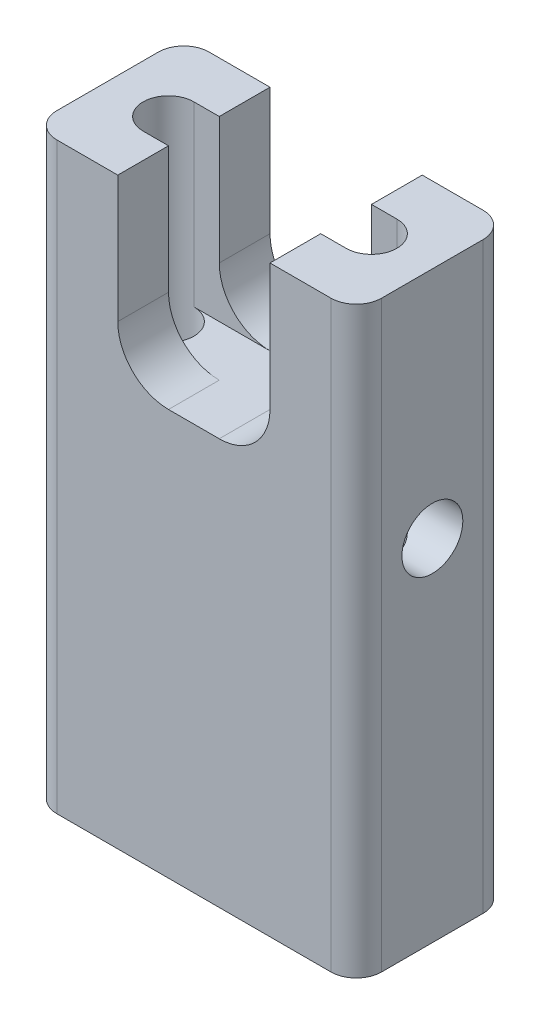
from build123d import *

# Parameters (mm, degrees)
BOSS_EXTRUDE1_DEPTH      = 35
BOSS_EXTRUDE1_DEPTH_BACK = 80
SKETCH1_W                = 64
SKETCH1_H                = 30
CUT_EXTRUDE1_DEPTH       = 10
CUT_EXTRUDE2_START       = -35
CUT_EXTRUDE2_DEPTH       = 35
CUT_EXTRUDE4_REACH       = 84.91
SKETCH6_R                = 8
SKETCH7_R                = 5
CUT_EXTRUDE5_DEPTH       = 65
CUT_EXTRUDE6_START       = -52
SKETCH8_R                = 6
CUT_EXTRUDE6_DEPTH       = 52
CUT_EXTRUDE7_DEPTH       = 35
CUT_EXTRUDE8_REACH       = 93.236
FILLET1_R                = 5


with BuildPart() as part:
    # Sketch1 → Boss-Extrude1 (new, two sides: drawn at the far end of the back side and taken through both)
    with BuildSketch(Plane(origin=(0, 0, 0), x_dir=(1, 0, 0), z_dir=(0, 1, 0)).offset(-BOSS_EXTRUDE1_DEPTH_BACK)):
        Rectangle(SKETCH1_W, SKETCH1_H)
    extrude(amount=BOSS_EXTRUDE1_DEPTH + BOSS_EXTRUDE1_DEPTH_BACK)

    # Sketch2 → Cut-Extrude1 (cut)
    with BuildSketch(Plane(origin=(0, -70, 0), x_dir=(1, 0, 0), z_dir=(0, 1, 0))):
        with BuildLine():
            Line((-24.5, 13), (24.5, 13))
            ThreePointArc((24.5, 13), (26.621320344, 12.121320344), (27.5, 10))
            Line((27.5, 10), (27.5, -10))
            ThreePointArc((27.5, -10), (26.621320344, -12.121320344), (24.5, -13))
            Line((24.5, -13), (-24.5, -13))
            ThreePointArc((-24.5, -13), (-26.621320344, -12.121320344), (-27.5, -10))
            Line((-27.5, -10), (-27.5, 10))
            ThreePointArc((-27.5, 10), (-26.621320344, 12.121320344), (-24.5, 13))
        make_face()
    extrude(amount=-CUT_EXTRUDE1_DEPTH, mode=Mode.SUBTRACT)

    # Sketch4 → Cut-Extrude2 (cut)
    with BuildSketch(Plane.XZ.offset(70).offset(CUT_EXTRUDE2_START)):
        with BuildLine():
            Line((-4.55, -12.177746097), (-22.1, -5.620498199))
            ThreePointArc((-22.1, -5.620498199), (-26, 0), (-22.1, 5.620498199))
            Line((-22.1, 5.620498199), (-4.55, 12.177746097))
            ThreePointArc((-4.55, 12.177746097), (13, 0), (-4.55, -12.177746097))
        make_face()
    extrude(amount=CUT_EXTRUDE2_DEPTH, mode=Mode.SUBTRACT)

    # Sketch6 → Cut-Extrude4 (cut, up to next)
    with BuildSketch(Plane(origin=(0, -5, 0), x_dir=(1, 0, 0), z_dir=(0, 1, 0)), mode=Mode.PRIVATE) as cut_extrude4_sk1:
        with Locations(Location((0, 0, 0), (0, 0, 180))):
            Circle(SKETCH6_R)
    cut_extrude4_tool1 = extrude(cut_extrude4_sk1.sketch, amount=-CUT_EXTRUDE4_REACH, mode=Mode.PRIVATE) & part.part
    add(cut_extrude4_tool1.solids().sort_by_distance((0, -5, 0))[0], mode=Mode.SUBTRACT)

    # Sketch7 → Cut-Extrude5 (cut)
    with BuildSketch(Plane(origin=(0, 35, 0), x_dir=(1, 0, 0), z_dir=(0, 1, 0))):
        with Locations(Location((20, 0, 0), (0, 0, 270))):
            Circle(SKETCH7_R)
        with Locations(Location((-20, 0, 0), (0, 0, 270))):
            Circle(SKETCH7_R)
    extrude(amount=-CUT_EXTRUDE5_DEPTH, mode=Mode.SUBTRACT)

    # Sketch8 → Cut-Extrude6 (cut)
    with BuildSketch(Plane(origin=(32, 0, 0), x_dir=(0, 0, -1), z_dir=(1, 0, 0)).offset(CUT_EXTRUDE6_START)):
        with Locations((0, -11)):
            Circle(SKETCH8_R)
    extrude(amount=CUT_EXTRUDE6_DEPTH, mode=Mode.SUBTRACT)

    # Sketch12 → Cut-Extrude7 (cut)
    with BuildSketch(Plane(origin=(0, 35, 0), x_dir=(1, 0, 0), z_dir=(0, 1, 0))):
        with BuildLine():
            Line((-20, 5), (20, 5))
            ThreePointArc((20, 5), (25, 0), (20, -5))
            Line((20, -5), (-20, -5))
            ThreePointArc((-20, -5), (-25, 0), (-20, 5))
        make_face()
    extrude(amount=-CUT_EXTRUDE7_DEPTH, mode=Mode.SUBTRACT)

    # Cut-Extrude8: up to this face of the body (flat: up to its plane)
    cut_extrude8_end = Plane(part.part.faces().sort_by_distance((0, -22.5, 15))[0])
    # Sketch13 → Cut-Extrude8 (cut, up to the picked face)
    with BuildSketch(Plane(origin=(0, 0, -15), x_dir=(-1, 0, 0), z_dir=(0, 0, -1)), mode=Mode.PRIVATE) as cut_extrude8_sk1:
        with BuildLine():
            Line((-15, 35), (15, 35))
            Line((15, 35), (15, 10))
            ThreePointArc((15, 10), (12.071067812, 2.928932188), (5, 0))
            Line((5, 0), (-5, 0))
            ThreePointArc((-5, 0), (-12.071067812, 2.928932188), (-15, 10))
            Line((-15, 10), (-15, 35))
        make_face()
    cut_extrude8_tool1 = split(extrude(cut_extrude8_sk1.sketch, amount=-CUT_EXTRUDE8_REACH, mode=Mode.PRIVATE), bisect_by=cut_extrude8_end, keep=Keep.BOTH, mode=Mode.PRIVATE)
    add(cut_extrude8_tool1.solids().sort_by(Axis((0, 18.15063, -15), (0, 0, 1)))[0], mode=Mode.SUBTRACT)

    # Fillet1
    fillet1_edges = [part.edges().sort_by_distance(p)[0] for p in [
        (32, -22.5, 15),
        (-32, -22.5, 15),
        (-32, -22.5, -15),
        (32, -22.5, -15),
    ]]
    fillet(fillet1_edges, radius=FILLET1_R)


solid = part.part
